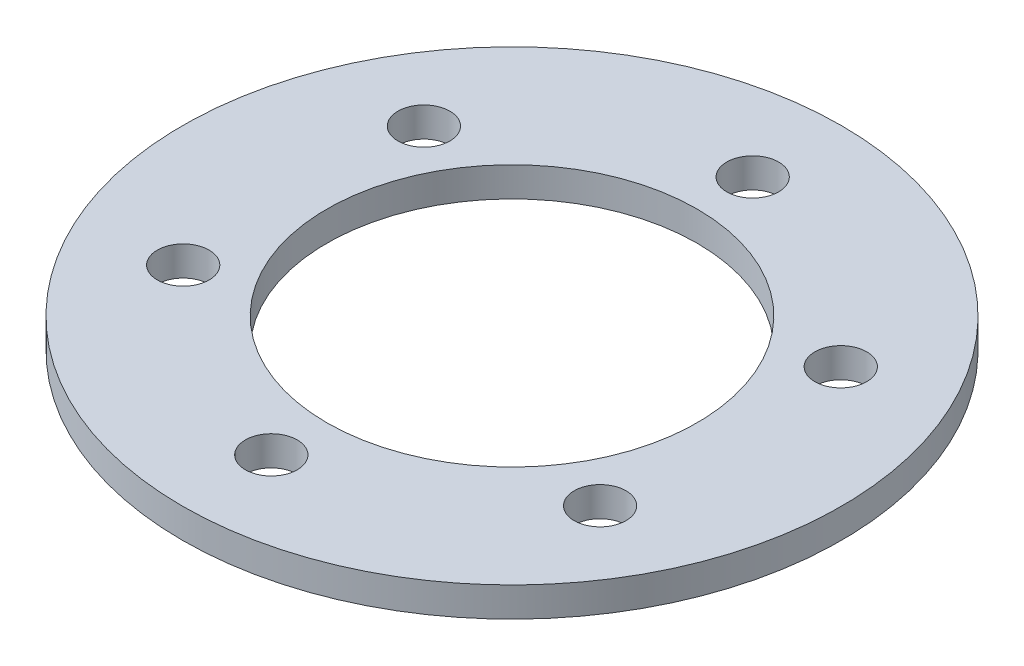
from build123d import *

# Parameters (mm, degrees)
SKETCH1_R           = 22.25
SKETCH1_R_2         = 12.5
SKETCH1_R_3         = 1.75
BOSS_EXTRUDE1_DEPTH = 2


with BuildPart() as part:
    # Sketch1 → Boss-Extrude1 (new body)
    with BuildSketch(Plane(origin=(0, 0, 0), x_dir=(1, 0, 0), z_dir=(0, 1, 0))):
        with Locations(Location((0, 0, 0), (0, 0, 270))):
            Circle(SKETCH1_R)
        with Locations(Location((0, 0, 0), (0, 0, 270))):
            Circle(SKETCH1_R_2, mode=Mode.SUBTRACT)
        with Locations(Location((0, 16.25, 0), (0, 0, 270))):
            Circle(SKETCH1_R_3, mode=Mode.SUBTRACT)
        with Locations(Location((14.072912811, 8.125, 0), (0, 0, 270))):
            Circle(SKETCH1_R_3, mode=Mode.SUBTRACT)
        with Locations(Location((14.072912811, -8.125, 0), (0, 0, 270))):
            Circle(SKETCH1_R_3, mode=Mode.SUBTRACT)
        with Locations(Location((0, -16.25, 0), (0, 0, 270))):
            Circle(SKETCH1_R_3, mode=Mode.SUBTRACT)
        with Locations(Location((-14.072912811, -8.125, 0), (0, 0, 270))):
            Circle(SKETCH1_R_3, mode=Mode.SUBTRACT)
        with Locations(Location((-14.072912811, 8.125, 0), (0, 0, 270))):
            Circle(SKETCH1_R_3, mode=Mode.SUBTRACT)
    extrude(amount=BOSS_EXTRUDE1_DEPTH)


solid = part.part
